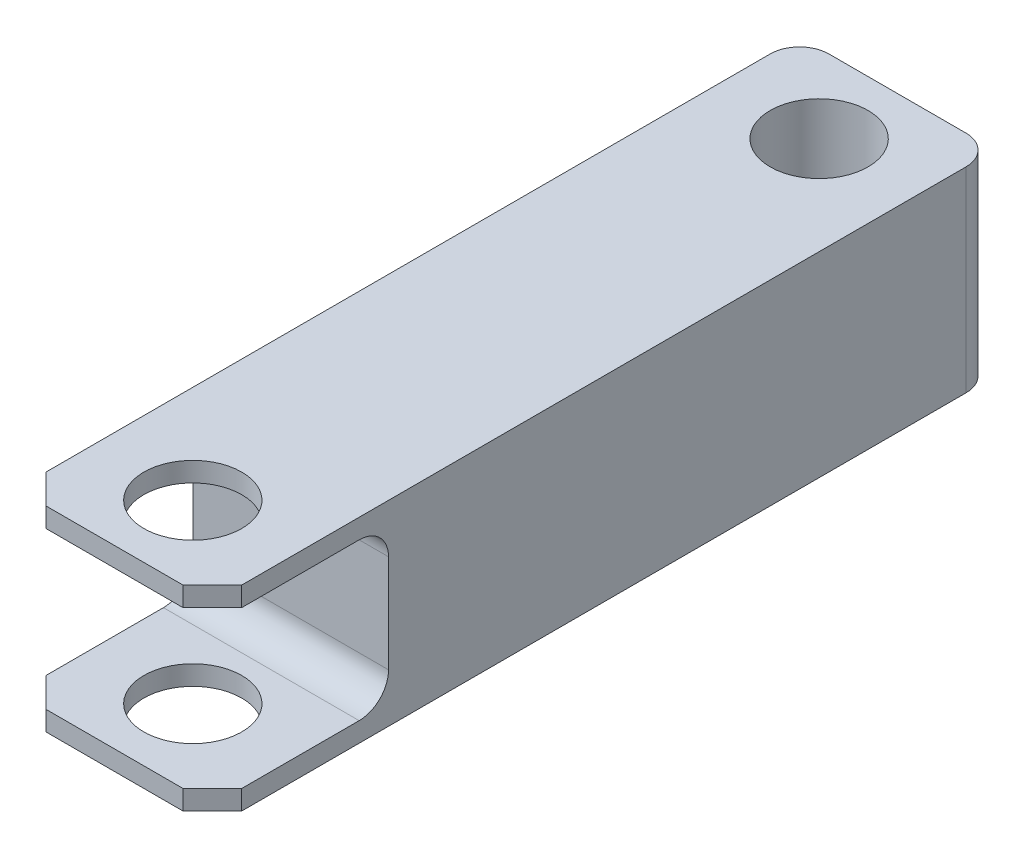
from build123d import *

# Parameters (mm, degrees)
SKETCH1_W           = 20
SKETCH1_H           = 20
BOSS_EXTRUDE1_DEPTH = 80
SKETCH2_R           = 5
CUT_EXTRUDE1_DEPTH  = 80
SKETCH3_W           = 20
SKETCH3_H           = 16
CUT_EXTRUDE2_DEPTH  = 18
SKETCH4_R           = 5
CUT_EXTRUDE3_DEPTH  = 92
FILLET1_R           = 3
CHAMFER1_SIZE       = 3


with BuildPart() as part:
    # Sketch1 → Boss-Extrude1 (new body)
    with BuildSketch(Plane.XY):
        Rectangle(SKETCH1_W, SKETCH1_H)
    extrude(amount=BOSS_EXTRUDE1_DEPTH)

    # Sketch2 → Cut-Extrude1 (cut)
    with BuildSketch(Plane(origin=(0, 10, 0), x_dir=(1, 0, 0), z_dir=(0, 1, 0))):
        with Locations(Location((0, -8, 0), (0, 0, 270))):
            Circle(SKETCH2_R)
    extrude(amount=-CUT_EXTRUDE1_DEPTH, mode=Mode.SUBTRACT)

    # Sketch3 → Cut-Extrude2 (cut)
    with BuildSketch(Plane.XY.offset(80)):
        Rectangle(SKETCH3_W, SKETCH3_H)
    extrude(amount=-CUT_EXTRUDE2_DEPTH, mode=Mode.SUBTRACT)

    # Sketch4 → Cut-Extrude3 (cut)
    with BuildSketch(Plane.XZ.offset(10)):
        with Locations(Location((0, 72, 0), (0, 0, 270))):
            Circle(SKETCH4_R)
    extrude(amount=-CUT_EXTRUDE3_DEPTH, mode=Mode.SUBTRACT)

    # Fillet1
    fillet1_edges = [part.edges().sort_by_distance(p)[0] for p in [
        (0, 8, 62),
        (0, -8, 62),
        (-10, 0, 0),
        (10, 0, 0),
    ]]
    fillet(fillet1_edges, radius=FILLET1_R)

    # Chamfer1
    chamfer1_edges = [part.edges().sort_by_distance(p)[0] for p in [
        (-10, 9, 80),
        (10, 9, 80),
        (-10, -9, 80),
        (10, -9, 80),
    ]]
    chamfer(chamfer1_edges, length=CHAMFER1_SIZE)


solid = part.part
